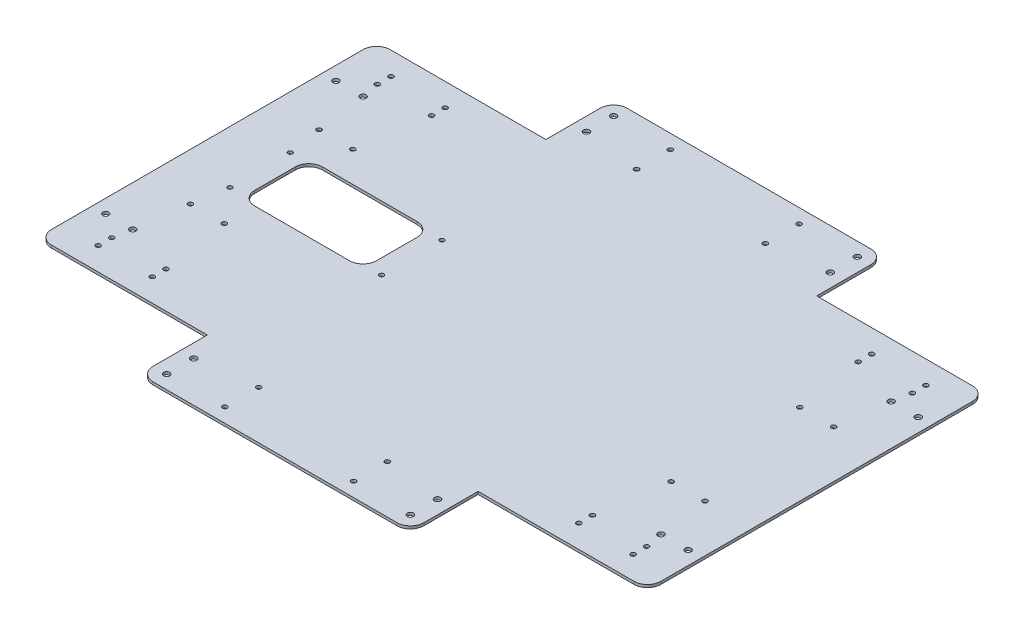
from build123d import *

# Parameters (mm, degrees)
SKETCH5_W            = 450
SKETCH5_H            = 350
BOSS_EXTRUDE1_DEPTH  = 2
FILLET1_R            = 10
CUT_EXTRUDE1_DEPTH   = 571.091220771
M4_CLEARANCE_HOLE1_D = 4.5
SKETCH13_R           = 1.75
CUT_EXTRUDE2_DEPTH   = 571.091220771
SKETCH14_R           = 1.75
CUT_EXTRUDE3_DEPTH   = 571.091220771
SKETCH15_W           = 125
SKETCH15_H           = 50
CUT_EXTRUDE4_DEPTH   = 571.091220771
FILLET2_R            = 10
SKETCH16_R           = 1.65
CUT_EXTRUDE5_DEPTH   = 571.091220771


with BuildPart() as part:
    # Sketch5 → Boss-Extrude1 (new body)
    with BuildSketch(Plane(origin=(0, 0, 0), x_dir=(1, 0, 0), z_dir=(0, 1, 0))):
        with Locations((225, 175)):
            Rectangle(SKETCH5_W, SKETCH5_H)
    extrude(amount=BOSS_EXTRUDE1_DEPTH)

    # Fillet1
    fillet1_edges = [part.edges().sort_by_distance(p)[0] for p in [
        (0, 1, 0),
        (0, 1, -350),
        (450, 1, -350),
        (450, 1, 0),
    ]]
    fillet(fillet1_edges, radius=FILLET1_R)

    # Sketch6 → Cut-Extrude1 (cut, through all)
    with BuildSketch(Plane(origin=(0, 2, 0), x_dir=(1, 0, 0), z_dir=(0, 1, 0))):
        with BuildLine():
            Line((140, 190), (140, 160))
            ThreePointArc((140, 160), (137.071067812, 152.928932188), (130, 150))
            Line((130, 150), (60, 150))
            ThreePointArc((60, 150), (52.928932188, 152.928932188), (50, 160))
            Line((50, 160), (50, 190))
            ThreePointArc((50, 190), (52.928932188, 197.071067812), (60, 200))
            Line((60, 200), (130, 200))
            ThreePointArc((130, 200), (137.071067812, 197.071067812), (140, 190))
        make_face()
    extrude(amount=-CUT_EXTRUDE1_DEPTH, mode=Mode.SUBTRACT)

    # M4 Clearance Hole1 (through all)
    with Locations(Plane(origin=(0, 2, 0), x_dir=(1, 0, 0), z_dir=(0, 1, 0))):
        with Locations((135, 10), (135, 30), (10, 90), (30, 90), (315, 10), (315, 30), (420, 90), (440, 90), (440, 260), (420, 260), (315, 340), (315, 320), (135, 340), (135, 320), (30, 260), (10, 260)):
            Hole(M4_CLEARANCE_HOLE1_D / 2)

    # Sketch13 → Cut-Extrude2 (cut, through all)
    with BuildSketch(Plane(origin=(0, 2, 0), x_dir=(1, 0, 0), z_dir=(0, 1, 0))):
        with Locations(Location((272.499999169, 35.5, 0), (0, 0, 90))):
            Circle(SKETCH13_R)
        with Locations(Location((272.499999169, 10.5, 0), (0, 0, 90))):
            Circle(SKETCH13_R)
        with Locations(Location((177.499999169, 35.5, 0), (0, 0, 90))):
            Circle(SKETCH13_R)
        with Locations(Location((177.499999169, 10.5, 0), (0, 0, 90))):
            Circle(SKETCH13_R)
        with Locations(Location((35, 222.5, 0), (0, 0, 270))):
            Circle(SKETCH13_R)
        with Locations(Location((60, 222.5, 0), (0, 0, 270))):
            Circle(SKETCH13_R)
        with Locations(Location((60, 127.5, 0), (0, 0, 270))):
            Circle(SKETCH13_R)
        with Locations(Location((35, 127.5, 0), (0, 0, 270))):
            Circle(SKETCH13_R)
        with Locations(Location((177.499999169, 339.5, 0), (0, 0, 270))):
            Circle(SKETCH13_R)
        with Locations(Location((272.499999169, 339.5, 0), (0, 0, 270))):
            Circle(SKETCH13_R)
        with Locations(Location((272.499999169, 314.5, 0), (0, 0, 270))):
            Circle(SKETCH13_R)
        with Locations(Location((177.499999169, 314.5, 0), (0, 0, 270))):
            Circle(SKETCH13_R)
        with Locations(Location((415, 127.5, 0), (0, 0, 90))):
            Circle(SKETCH13_R)
        with Locations(Location((390, 127.5, 0), (0, 0, 90))):
            Circle(SKETCH13_R)
        with Locations(Location((390, 222.5, 0), (0, 0, 90))):
            Circle(SKETCH13_R)
        with Locations(Location((415, 222.5, 0), (0, 0, 90))):
            Circle(SKETCH13_R)
    extrude(amount=-CUT_EXTRUDE2_DEPTH, mode=Mode.SUBTRACT)

    # Sketch14 → Cut-Extrude3 (cut, through all)
    with BuildSketch(Plane(origin=(0, 2, 0), x_dir=(1, 0, 0), z_dir=(0, 1, 0))):
        with Locations(Location((27.5, 76.9004, 0), (0, 0, 270))):
            Circle(SKETCH14_R)
        with Locations(Location((67.5, 76.9004, 0), (0, 0, 270))):
            Circle(SKETCH14_R)
        with Locations(Location((67.5, 66.9004, 0), (0, 0, 270))):
            Circle(SKETCH14_R)
        with Locations(Location((27.5, 66.9004, 0), (0, 0, 270))):
            Circle(SKETCH14_R)
        with Locations(Location((67.5, 283.0996, 0), (0, 0, 90))):
            Circle(SKETCH14_R)
        with Locations(Location((67.5, 273.0996, 0), (0, 0, 90))):
            Circle(SKETCH14_R)
        with Locations(Location((27.5, 283.0996, 0), (0, 0, 90))):
            Circle(SKETCH14_R)
        with Locations(Location((27.5, 273.0996, 0), (0, 0, 90))):
            Circle(SKETCH14_R)
        with Locations(Location((382.5, 273.0996, 0), (0, 0, 270))):
            Circle(SKETCH14_R)
        with Locations(Location((382.5, 283.0996, 0), (0, 0, 270))):
            Circle(SKETCH14_R)
        with Locations(Location((422.5, 283.0996, 0), (0, 0, 270))):
            Circle(SKETCH14_R)
        with Locations(Location((422.5, 273.0996, 0), (0, 0, 270))):
            Circle(SKETCH14_R)
        with Locations(Location((422.5, 66.9004, 0), (0, 0, 90))):
            Circle(SKETCH14_R)
        with Locations(Location((382.5, 66.9004, 0), (0, 0, 90))):
            Circle(SKETCH14_R)
        with Locations(Location((382.5, 76.9004, 0), (0, 0, 90))):
            Circle(SKETCH14_R)
        with Locations(Location((422.5, 76.9004, 0), (0, 0, 90))):
            Circle(SKETCH14_R)
    extrude(amount=-CUT_EXTRUDE3_DEPTH, mode=Mode.SUBTRACT)

    # Sketch15 → Cut-Extrude4 (cut, through all)
    with BuildSketch(Plane(origin=(0, 2, 0), x_dir=(1, 0, 0), z_dir=(0, 1, 0))):
        with Locations((62.5, 325)):
            Rectangle(SKETCH15_W, SKETCH15_H)
        with Locations((62.5, 25)):
            Rectangle(SKETCH15_W, SKETCH15_H)
        with Locations((387.5, 25)):
            Rectangle(SKETCH15_W, SKETCH15_H)
        with Locations((387.5, 325)):
            Rectangle(SKETCH15_W, SKETCH15_H)
    extrude(amount=-CUT_EXTRUDE4_DEPTH, mode=Mode.SUBTRACT)

    # Fillet2
    fillet2_edges = [part.edges().sort_by_distance(p)[0] for p in [
        (325, 1, -350),
        (450, 1, -300),
        (450, 1, -50),
        (325, 1, 0),
        (125, 1, 0),
        (0, 1, -50),
        (0, 1, -300),
        (125, 1, -350),
    ]]
    fillet(fillet2_edges, radius=FILLET2_R)

    # Sketch16 → Cut-Extrude5 (cut, through all)
    with BuildSketch(Plane(origin=(0, 2, 0), x_dir=(1, 0, 0), z_dir=(0, 1, 0))):
        with Locations(Location((39, 197.3, 0), (0, 0, 270))):
            Circle(SKETCH16_R)
        with Locations(Location((39, 152.7, 0), (0, 0, 270))):
            Circle(SKETCH16_R)
        with Locations(Location((151, 152.7, 0), (0, 0, 90))):
            Circle(SKETCH16_R)
        with Locations(Location((151, 197.3, 0), (0, 0, 90))):
            Circle(SKETCH16_R)
    extrude(amount=-CUT_EXTRUDE5_DEPTH, mode=Mode.SUBTRACT)


solid = part.part
